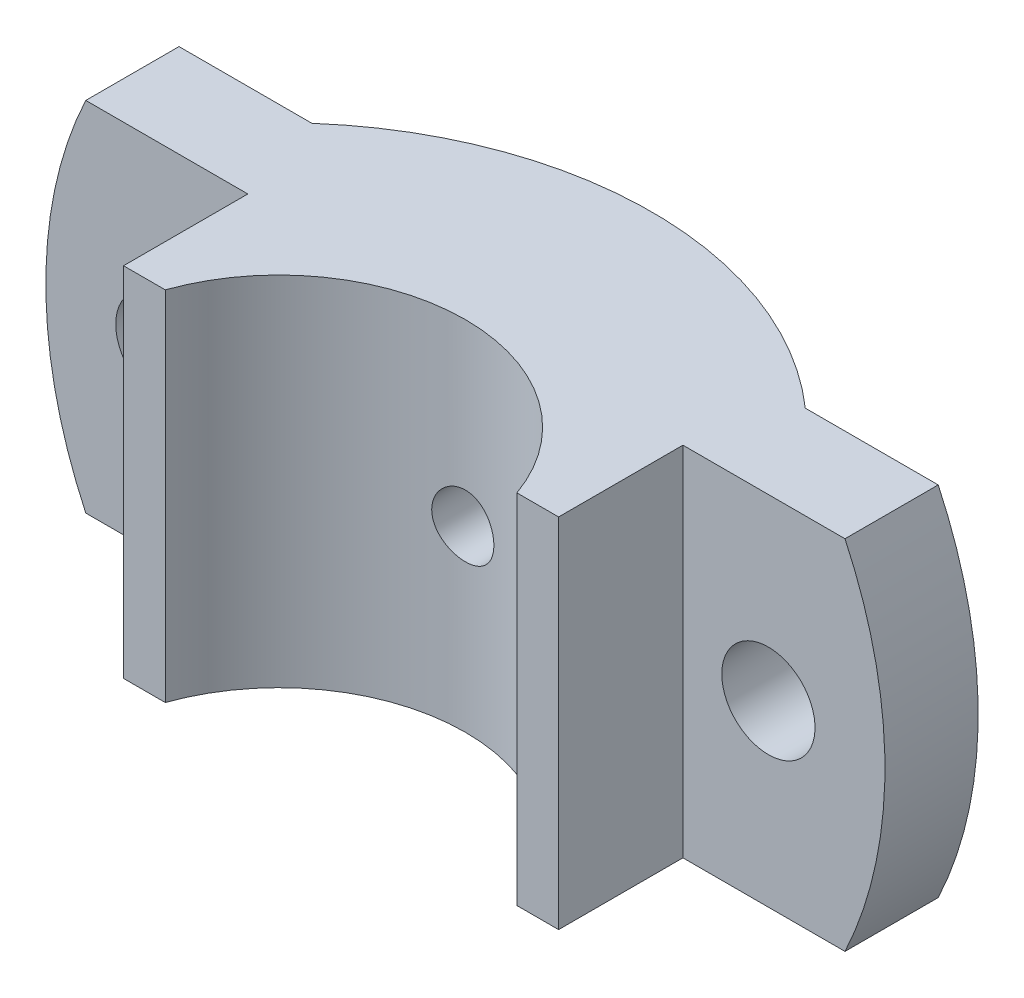
from build123d import *

# Parameters (mm, degrees)
BOSS_EXTRUDE1_DEPTH = 46
SKETCH2_R           = 6
CUT_EXTRUDE1_DEPTH  = 77.26270386
SKETCH3_R           = 4
CUT_EXTRUDE2_DEPTH  = 24
CUT_EXTRUDE4_START  = 48
SKETCH2_5_R         = 6
CUT_EXTRUDE4_DEPTH  = 48


with BuildPart() as part:
    # Sketch1 → Boss-Extrude1 (new body)
    with BuildSketch(Plane(origin=(0, 0, 0), x_dir=(1, 0, 0), z_dir=(0, 1, 0))):
        with BuildLine():
            Line((-54, 0), (-28, 0))
            Line((-28, 0), (-28, -16))
            Line((-28, -16), (-22.627416998, -16))
            ThreePointArc((-22.627416998, -16), (0, 0), (22.627416998, -16))
            Line((22.627416998, -16), (28, -16))
            Line((28, -16), (28, 0))
            Line((28, 0), (54, 0))
            Line((54, 0), (54, 12))
            Line((54, 12), (31.749015733, 12))
            ThreePointArc((31.749015733, 12), (0, 24), (-31.749015733, 12))
            Line((-31.749015733, 12), (-54, 12))
            Line((-54, 12), (-54, 0))
        make_face()
    extrude(amount=BOSS_EXTRUDE1_DEPTH)

    # Sketch2 → Cut-Extrude1 (cut, through all)
    with BuildSketch(Plane(origin=(0, 0, -12), x_dir=(-1, 0, 0), z_dir=(0, 0, -1))):
        with BuildLine():
            Line((-48.856934001, 46), (-54, 46))
            Line((-54, 46), (-54, 23))
            ThreePointArc((-54, 23), (-52.698550436, 34.784005345), (-48.856934001, 46))
        make_face()
        with BuildLine():
            ThreePointArc((-48.856934001, 0), (-52.698550436, 11.215994655), (-54, 23))
            Line((-54, 23), (-54, 0))
            Line((-54, 0), (-48.856934001, 0))
        make_face()
        with BuildLine():
            Line((54, 23), (54, 46))
            Line((54, 46), (48.856934001, 46))
            ThreePointArc((48.856934001, 46), (52.698550436, 34.784005345), (54, 23))
        make_face()
        with BuildLine():
            Line((54, 0), (54, 23))
            ThreePointArc((54, 23), (52.698550436, 11.215994655), (48.856934001, 0))
            Line((48.856934001, 0), (54, 0))
        make_face()
        with Locations((-39, 23)):
            Circle(SKETCH2_R)
        with Locations((39, 23)):
            Circle(SKETCH2_R)
    extrude(amount=-CUT_EXTRUDE1_DEPTH, mode=Mode.SUBTRACT)

    # Sketch3 → Cut-Extrude2 (cut, symmetric)
    with BuildSketch(Plane(origin=(0, 0, -12), x_dir=(-1, 0, 0), z_dir=(0, 0, -1))):
        with Locations((0, 23)):
            Circle(SKETCH3_R)
    extrude(amount=CUT_EXTRUDE2_DEPTH, both=True, mode=Mode.SUBTRACT)

    # Sketch2<5> → Cut-Extrude4 (cut)
    # profile 1 of 2: a face of its own
    with BuildSketch(Plane(origin=(0, 0, -12), x_dir=(-1, 0, 0), z_dir=(0, 0, -1)).offset(CUT_EXTRUDE4_START)):
        with BuildLine():
            Line((-39, 46), (-48.856934001, 46))
            ThreePointArc((-48.856934001, 46), (-54, 23), (-48.856934001, 0))
            Line((-48.856934001, 0), (-39, 0))
            Line((-39, 0), (-39, 6))
            ThreePointArc((-39, 6), (-22, 23), (-39, 40))
            Line((-39, 40), (-39, 46))
        make_face()
        with Locations((-39, 23)):
            Circle(SKETCH2_5_R, mode=Mode.SUBTRACT)
    # profile 2 of 2: a face of its own
    with BuildSketch(Plane(origin=(0, 0, -12), x_dir=(-1, 0, 0), z_dir=(0, 0, -1)).offset(CUT_EXTRUDE4_START)):
        with BuildLine():
            ThreePointArc((48.856934001, 0), (54, 23), (48.856934001, 46))
            Line((48.856934001, 46), (39, 46))
            Line((39, 46), (39, 40))
            ThreePointArc((39, 40), (22, 23), (39, 6))
            Line((39, 6), (39, 0))
            Line((39, 0), (48.856934001, 0))
        make_face()
        with Locations((39, 23)):
            Circle(SKETCH2_5_R, mode=Mode.SUBTRACT)
    extrude(amount=-CUT_EXTRUDE4_DEPTH, mode=Mode.SUBTRACT)


solid = part.part
